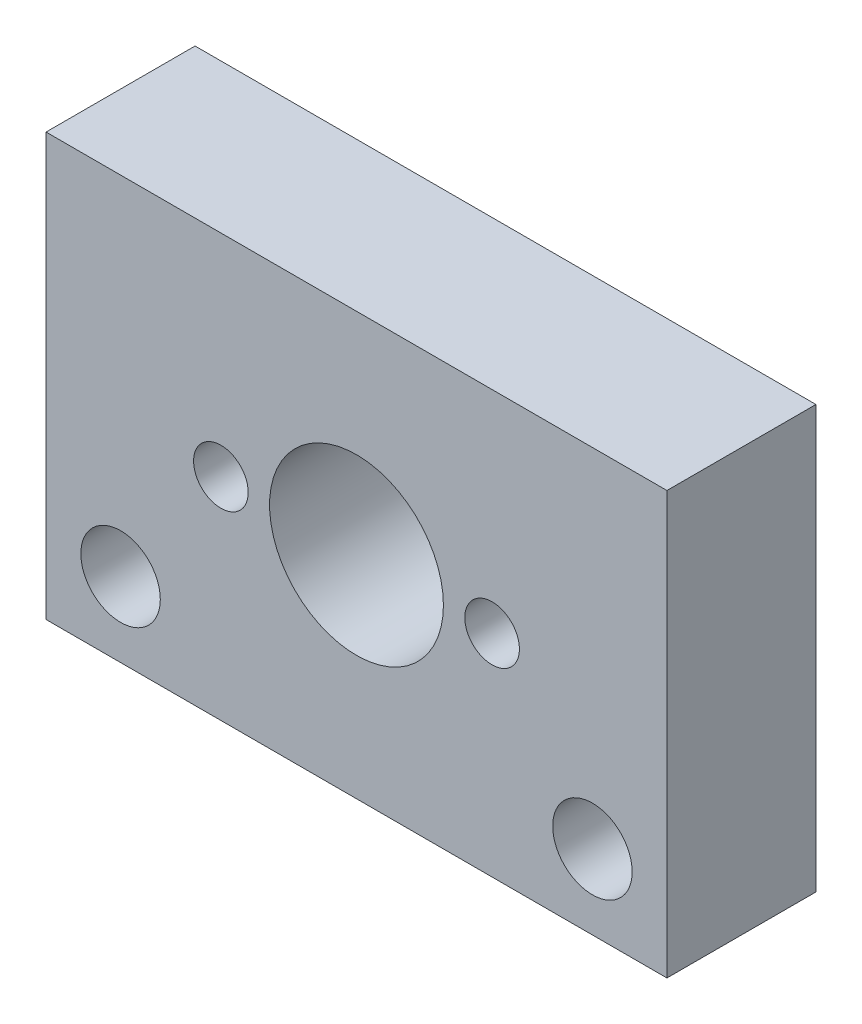
from build123d import *

# Parameters (mm, degrees)
SKIZZE1_W                        = 25
SKIZZE1_H                        = 17
AUFSATZ_LINEAR_AUSTRAGEN1_DEPTH  = 6
F_3_2_3_2_DURCHMESSER_BOHRUNG1_D = 3.2
F_7_0_7_DURCHMESSER_BOHRUNG1_D   = 7
F_2_2_2_2_DURCHMESSER_BOHRUNG1_D = 2.2


with BuildPart() as part:
    # Skizze1 → Aufsatz-Linear austragen1 (new body)
    with BuildSketch(Plane.XY):
        Rectangle(SKIZZE1_W, SKIZZE1_H)
    extrude(amount=AUFSATZ_LINEAR_AUSTRAGEN1_DEPTH)

    # Ø3.2 (3.2) Durchmesser Bohrung1 (through all)
    with Locations(Plane.XY.offset(6)):
        with Locations((-9.5, -5.5), (9.5, -5.5)):
            Hole(F_3_2_3_2_DURCHMESSER_BOHRUNG1_D / 2)

    # Ø7.0 (7) Durchmesser Bohrung1 (through all)
    with Locations(Plane.XY.offset(6)):
        with Locations((0, 0)):
            Hole(F_7_0_7_DURCHMESSER_BOHRUNG1_D / 2)

    # Ø2.2 (2.2) Durchmesser Bohrung1 (through all)
    with Locations(Plane.XY.offset(6)):
        with Locations((-5.46, 0), (5.46, 0)):
            Hole(F_2_2_2_2_DURCHMESSER_BOHRUNG1_D / 2)


solid = part.part
